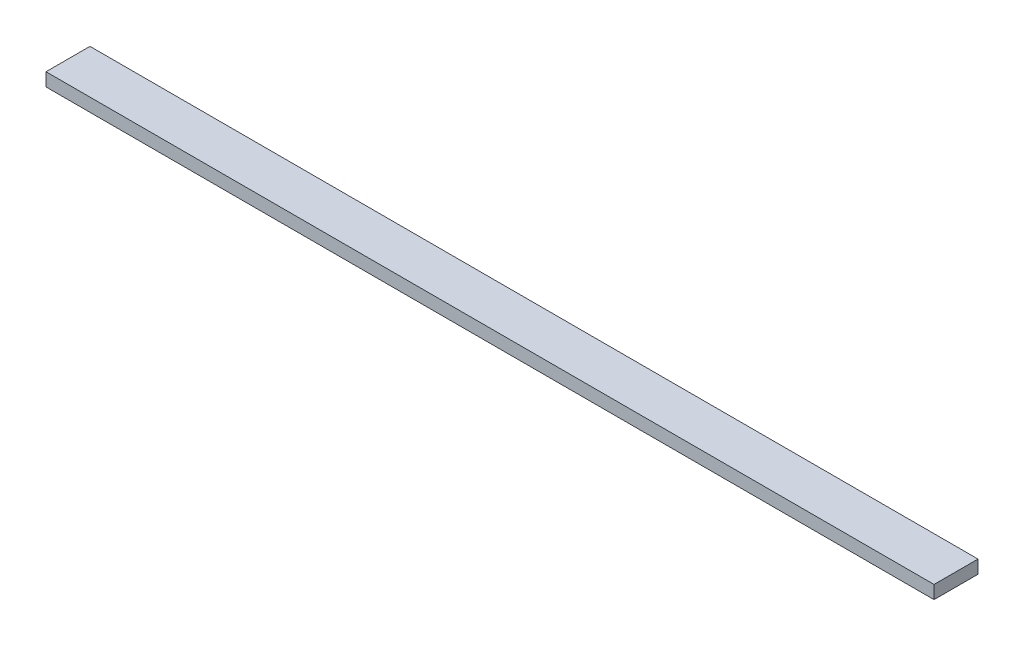
from build123d import *

# Parameters (mm, degrees)
SKETCH1_W           = 202
SKETCH1_H           = 10
BOSS_EXTRUDE1_DEPTH = 1.5


with BuildPart() as part:
    # Sketch1 → Boss-Extrude1 (new, symmetric)
    with BuildSketch(Plane(origin=(0, 0, 0), x_dir=(1, 0, 0), z_dir=(0, 1, 0))):
        Rectangle(SKETCH1_W, SKETCH1_H)
    extrude(amount=BOSS_EXTRUDE1_DEPTH, both=True)


solid = part.part
